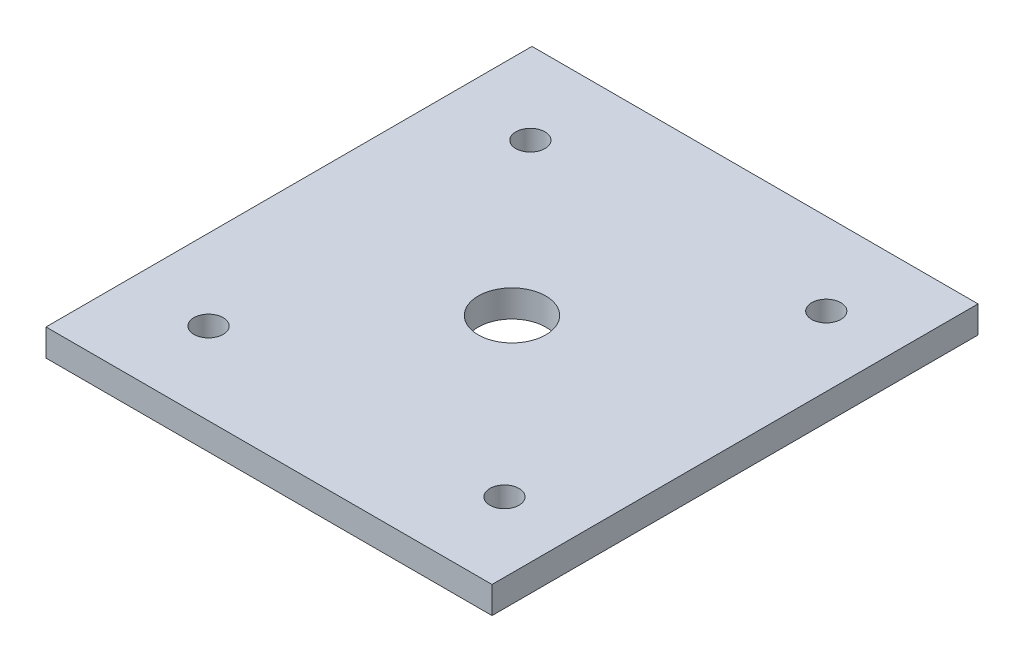
from build123d import *

# Parameters (mm, degrees)
SKETCH1_W           = 104.902
SKETCH1_H           = 114.3
BOSS_EXTRUDE1_DEPTH = 6.35
CUT_EXTRUDE2_REACH  = 79.83
SKETCH3_R           = 3.429
CUT_EXTRUDE3_REACH  = 79.83
SKETCH4_R           = 7.9375


with BuildPart() as part:
    # Sketch1 → Boss-Extrude1 (new body)
    with BuildSketch(Plane(origin=(0, 0, 0), x_dir=(1, 0, 0), z_dir=(0, 1, 0))):
        Rectangle(SKETCH1_W, SKETCH1_H)
    extrude(amount=BOSS_EXTRUDE1_DEPTH)

    # Sketch3 → Cut-Extrude2 (cut, up to next)
    with BuildSketch(Plane.XZ, mode=Mode.PRIVATE) as cut_extrude2_sk1:
        with Locations(Location((-33.528, 37.846, 0), (0, 0, 270))):
            Circle(SKETCH3_R)
    cut_extrude2_tool1 = extrude(cut_extrude2_sk1.sketch, amount=-CUT_EXTRUDE2_REACH, mode=Mode.PRIVATE) & part.part
    # Sketch3 → Cut-Extrude2 (cut, up to next)
    with BuildSketch(Plane.XZ, mode=Mode.PRIVATE) as cut_extrude2_sk2:
        with Locations(Location((-33.528, -37.846, 0), (0, 0, 90))):
            Circle(SKETCH3_R)
    cut_extrude2_tool2 = extrude(cut_extrude2_sk2.sketch, amount=-CUT_EXTRUDE2_REACH, mode=Mode.PRIVATE) & part.part
    # Sketch3 → Cut-Extrude2 (cut, up to next)
    with BuildSketch(Plane.XZ, mode=Mode.PRIVATE) as cut_extrude2_sk3:
        with Locations(Location((36.068, 37.846, 0), (0, 0, 90))):
            Circle(SKETCH3_R)
    cut_extrude2_tool3 = extrude(cut_extrude2_sk3.sketch, amount=-CUT_EXTRUDE2_REACH, mode=Mode.PRIVATE) & part.part
    # Sketch3 → Cut-Extrude2 (cut, up to next)
    with BuildSketch(Plane.XZ, mode=Mode.PRIVATE) as cut_extrude2_sk4:
        with Locations(Location((36.068, -37.846, 0), (0, 0, 270))):
            Circle(SKETCH3_R)
    cut_extrude2_tool4 = extrude(cut_extrude2_sk4.sketch, amount=-CUT_EXTRUDE2_REACH, mode=Mode.PRIVATE) & part.part
    add(cut_extrude2_tool1.solids().sort_by_distance((-33.528, 0, 37.846))[0], mode=Mode.SUBTRACT)
    add(cut_extrude2_tool2.solids().sort_by_distance((-33.528, 0, -37.846))[0], mode=Mode.SUBTRACT)
    add(cut_extrude2_tool3.solids().sort_by_distance((36.068, 0, 37.846))[0], mode=Mode.SUBTRACT)
    add(cut_extrude2_tool4.solids().sort_by_distance((36.068, 0, -37.846))[0], mode=Mode.SUBTRACT)

    # Sketch4 → Cut-Extrude3 (cut, up to next)
    with BuildSketch(Plane.XZ, mode=Mode.PRIVATE) as cut_extrude3_sk1:
        with Locations(Location((0, 0, 0), (0, 0, 270))):
            Circle(SKETCH4_R)
    cut_extrude3_tool1 = extrude(cut_extrude3_sk1.sketch, amount=-CUT_EXTRUDE3_REACH, mode=Mode.PRIVATE) & part.part
    add(cut_extrude3_tool1.solids().sort_by_distance((0, 0, 0))[0], mode=Mode.SUBTRACT)


solid = part.part
